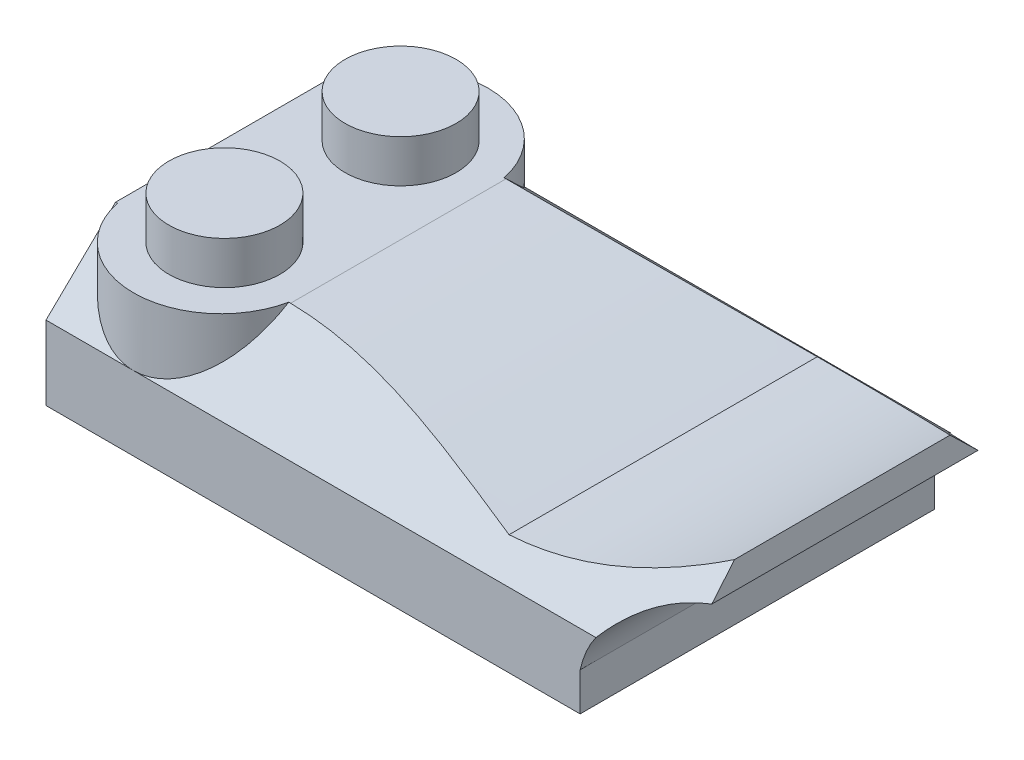
from build123d import *

# Parameters (mm, degrees)
SKETCH1_W           = 27.7
SKETCH1_H           = 15.8
BOSS_EXTRUDE1_DEPTH = 6.3
SKETCH2_OUTSIDE_W   = 36.202
SKETCH2_OUTSIDE_H   = 14.802
CUT_EXTRUDE1_DEPTH  = 15.9
SKETCH3_OUTSIDE_W   = 24.302
SKETCH3_OUTSIDE_H   = 14.802
CUT_EXTRUDE2_DEPTH  = 35.9
BOSS_EXTRUDE2_DEPTH = 6.3
SKETCH5_R           = 2.475
BOSS_EXTRUDE3_DEPTH = 1.9
SKETCH6_W           = 20.8
SKETCH6_H           = 12.8
CUT_EXTRUDE3_DEPTH  = 2


with BuildPart() as part:
    # Sketch1 → Boss-Extrude1 (new body)
    with BuildSketch(Plane(origin=(0, 0, 0), x_dir=(1, 0, 0), z_dir=(0, 1, 0))):
        with Locations((-20.178976781, 7.9)):
            Rectangle(SKETCH1_W, SKETCH1_H)
    extrude(amount=BOSS_EXTRUDE1_DEPTH)

    # Sketch2 outside → Cut-Extrude1 (cut)
    with BuildSketch(Plane.XY):
        with Locations((-20.179, 3.15)):
            Rectangle(SKETCH2_OUTSIDE_W, SKETCH2_OUTSIDE_H)
        with BuildLine():
            Line((-34.028976781, 0), (-10.228976781, 0))
            Line((-10.228976781, 0), (-10.228976781, 1.7))
            add(Edge.make_bspline(
                [(-10.228976781, 1.7), (-9.604071017, 4.446739352), (-6.328976781, 5.206240769)],
                knots=[0, 0, 0, 1, 1, 1], degree=2))
            Line((-6.328976781, 5.206240769), (-6.445984235, 6.3))
            add(Edge.make_bspline(
                [(-14.428976781, 4.3), (-10.215266521, 4.423026161), (-6.445984235, 6.3)],
                knots=[0, 0, 0, 1, 1, 1], degree=2))
            add(Edge.make_bspline(
                [(-26.228976781, 6.3), (-22.205866261, 6.270484551), (-18.300973194, 5.255436261), (-14.428976781, 4.3)],
                knots=[0, 0, 0, 0, 1, 1, 1, 1], degree=3))
            Line((-26.228976781, 6.3), (-34.028976781, 6.3))
            Line((-34.028976781, 6.3), (-34.028976781, 0))
        make_face(mode=Mode.SUBTRACT)
    extrude(amount=-CUT_EXTRUDE1_DEPTH, mode=Mode.SUBTRACT)

    # Sketch3 outside → Cut-Extrude2 (cut)
    with BuildSketch(Plane.ZY.offset(34.028976781)):
        with Locations((-7.9, 3.15)):
            Rectangle(SKETCH3_OUTSIDE_W, SKETCH3_OUTSIDE_H)
        Polygon((-15.8, 0), (-15.8, 3.3), (-12.7, 6.3), (-3.1, 6.3), (0, 3.3), (0, 0), align=None, mode=Mode.SUBTRACT)
    extrude(amount=-CUT_EXTRUDE2_DEPTH, mode=Mode.SUBTRACT)

    # Sketch4 → Boss-Extrude2 (add)
    with BuildSketch(Plane.XZ):
        with BuildLine():
            Line((-34.028976781, -3.9), (-34.028976781, -11.9))
            ThreePointArc((-34.028976781, -11.9), (-30.128976781, -15.8), (-26.228976781, -11.9))
            Line((-26.228976781, -11.9), (-26.228976781, -3.899999628))
            ThreePointArc((-26.228976781, -3.899999628), (-30.128976967, 1.86e-07), (-34.028976781, -3.9))
        make_face()
    extrude(amount=-BOSS_EXTRUDE2_DEPTH)

    # Sketch5 → Boss-Extrude3 (add)
    with BuildSketch(Plane(origin=(0, 6.3, 0), x_dir=(1, 0, 0), z_dir=(0, 1, 0))):
        with Locations(Location((-30.053976781, 11.82570761, 0), (0, 0, 90))):
            Circle(SKETCH5_R)
        with Locations(Location((-30.053976781, 3.974999814, 0), (0, 0, 90))):
            Circle(SKETCH5_R)
    extrude(amount=BOSS_EXTRUDE3_DEPTH)

    # Sketch6 → Cut-Extrude3 (cut)
    with BuildSketch(Plane.XZ):
        with Locations((-22.128976781, -7.9)):
            Rectangle(SKETCH6_W, SKETCH6_H)
    extrude(amount=-CUT_EXTRUDE3_DEPTH, mode=Mode.SUBTRACT)


solid = part.part
